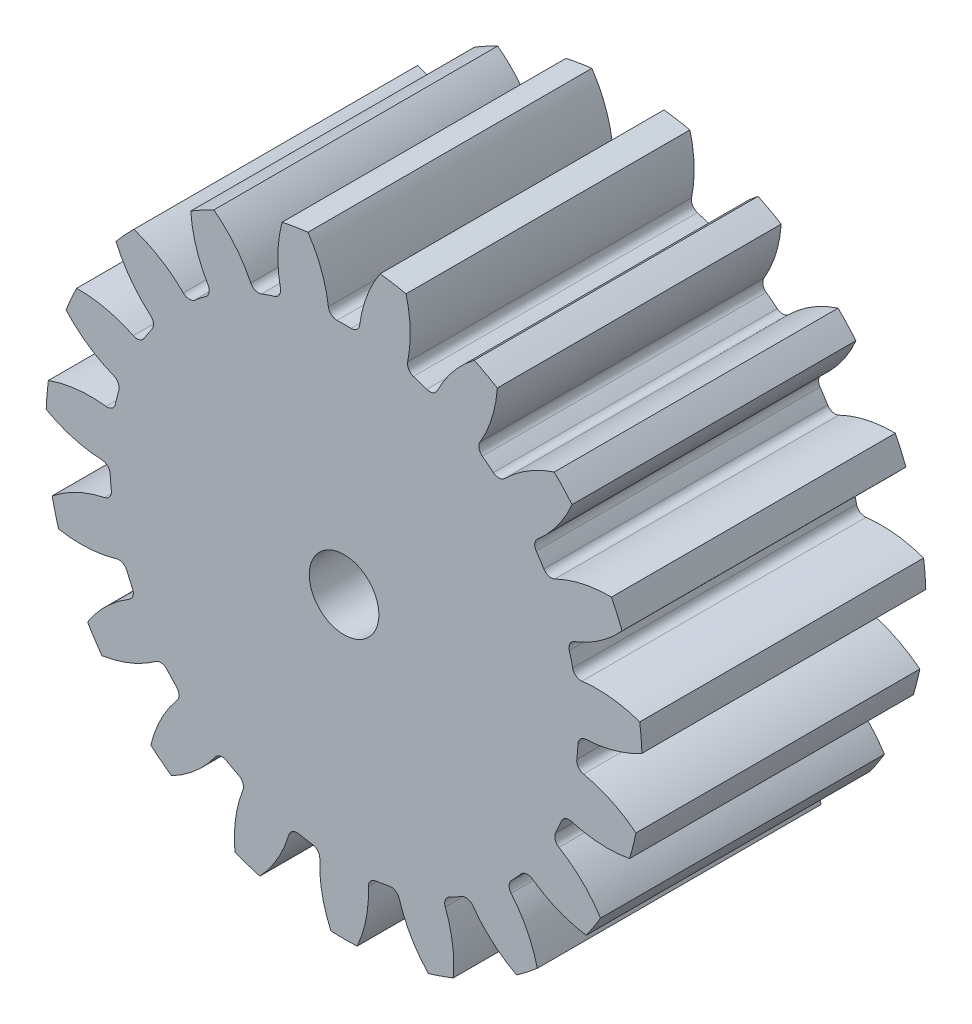
from build123d import *

# Parameters (mm, degrees)
SKETCH1_R                = 21
BOSS_EXTRUDE1_DEPTH      = 10
CUT_EXTRUDE2_DEPTH       = 32.336879232
FILLET1_R                = 0.6
CIRPATTERN3_COUNT        = 19
FILLET1_OF_CIRPATTERN3_R = 0.6
SKETCH3_R                = 2.45
CUT_EXTRUDE3_DEPTH       = 36.795867914
CUT_EXTRUDE4_DEPTH       = 11


with BuildPart() as part:
    # Sketch1 → Boss-Extrude1 (new, symmetric)
    with BuildSketch(Plane.XY):
        Circle(SKETCH1_R)
    extrude(amount=BOSS_EXTRUDE1_DEPTH, both=True)

    # Sketch2 → Cut-Extrude2 (cut, symmetric)
    with BuildSketch(Plane.XY):
        with BuildLine():
            ThreePointArc((-3.243684771, 21.759561326), (-1.708845639, 19.294769345), (-1.052023706, 16.466427849))
            ThreePointArc((-1.052023706, 16.466427849), (0, 16.5), (1.052023706, 16.466427849))
            ThreePointArc((1.052023706, 16.466427849), (1.708845639, 19.294769345), (3.243684771, 21.759561326))
            ThreePointArc((3.243684771, 21.759561326), (0, 22), (-3.243684771, 21.759561326))
        make_face()
    cut_extrude2 = extrude(amount=CUT_EXTRUDE2_DEPTH, both=True, mode=Mode.SUBTRACT)

    # Fillet1
    fillet1_edges = [part.edges().sort_by_distance(p)[0] for p in [
        (-1.052023706, 16.466427849, 0),
        (1.052023706, 16.466427849, 0),
    ]]
    fillet(fillet1_edges, radius=FILLET1_R)

    # CirPattern3: Cut-Extrude2 ×19 about axis
    cirpattern3_axis = Axis((0, 0, 0), (0, 0, 1))
    for i in range(1, CIRPATTERN3_COUNT):
        add(cut_extrude2.rotate(cirpattern3_axis, i * 360 / CIRPATTERN3_COUNT), mode=Mode.SUBTRACT)

    # Fillet1 of CirPattern3
    fillet1_of_cirpattern3_edges = [part.edges().sort_by_distance(p)[0] for p in [
        (-6.341662543, 15.23263983, 0),
        (-4.351618222, 15.915822908, 0),
        (-10.944083841, 12.348158927, 0),
        (-9.283694794, 13.640491596, 0),
        (-14.360543841, 8.125563402, 0),
        (-13.209738984, 9.887001364, 0),
        (-16.220816088, 3.022437001, 0),
        (-15.704302984, 5.062101123, 0),
        (-16.323311221, -2.408217346, 0),
        (-16.497062079, -0.311356322, 0),
        (-14.6569223, -7.577903977, 0),
        (-15.502108519, -5.651073478, 0),
        (-11.402228423, -11.926407128, 0),
        (-12.827260961, -10.378409138, 0),
        (-6.911926172, -14.98249901, 0),
        (-8.762380643, -13.981083129, 0),
        (-1.672609471, -16.415004647, 0),
        (-3.747960419, -16.068689825, 0),
        (3.747960419, -16.068689825, 0),
        (1.672609471, -16.415004647, 0),
        (8.762380643, -13.981083129, 0),
        (6.911926172, -14.98249901, 0),
        (12.827260961, -10.378409138, 0),
        (11.402228423, -11.926407128, 0),
        (15.502108519, -5.651073478, 0),
        (14.6569223, -7.577903977, 0),
        (16.497062079, -0.311356322, 0),
        (16.323311221, -2.408217346, 0),
        (15.704302984, 5.062101123, 0),
        (16.220816088, 3.022437001, 0),
        (13.209738984, 9.887001364, 0),
        (14.360543841, 8.125563402, 0),
        (9.283694794, 13.640491596, 0),
        (10.944083841, 12.348158927, 0),
        (4.351618222, 15.915822908, 0),
        (6.341662543, 15.23263983, 0),
    ]]
    fillet(fillet1_of_cirpattern3_edges, radius=FILLET1_OF_CIRPATTERN3_R)

    # Sketch3 → Cut-Extrude3 (cut, through all)
    with BuildSketch(Plane(origin=(0, 0, -10), x_dir=(-1, 0, 0), z_dir=(0, 0, -1))):
        Circle(SKETCH3_R)
    extrude(amount=-CUT_EXTRUDE3_DEPTH, mode=Mode.SUBTRACT)

    # Sketch4 → Cut-Extrude4 (cut)
    with BuildSketch(Plane(origin=(0, 0, -10), x_dir=(-1, 0, 0), z_dir=(0, 0, -1))):
        with BuildLine():
            ThreePointArc((0.594506224, 6.081008333), (0, 5.4), (-0.594506224, 6.081008333))
            ThreePointArc((-0.594506224, 6.081008333), (-0.955814581, 6.034775761), (-1.3137259, 5.967095127))
            ThreePointArc((-1.3137259, 5.967095127), (-1.66869177, 5.135705188), (-2.444543936, 5.599670075))
            ThreePointArc((-2.444543936, 5.599670075), (-2.773881953, 5.444049863), (-3.093361379, 5.269081075))
            ThreePointArc((-3.093361379, 5.269081075), (-3.174040362, 4.36869177), (-4.055292656, 4.570197094))
            ThreePointArc((-4.055292656, 4.570197094), (-4.320422433, 4.320422433), (-4.570197094, 4.055292656))
            ThreePointArc((-4.570197094, 4.055292656), (-4.36869177, 3.174040362), (-5.269081075, 3.093361379))
            ThreePointArc((-5.269081075, 3.093361379), (-5.444049863, 2.773881953), (-5.599670075, 2.444543936))
            ThreePointArc((-5.599670075, 2.444543936), (-5.135705188, 1.66869177), (-5.967095127, 1.3137259))
            ThreePointArc((-5.967095127, 1.3137259), (-6.034775761, 0.955814581), (-6.081008333, 0.594506224))
            ThreePointArc((-6.081008333, 0.594506224), (-5.4, 0), (-6.081008333, -0.594506224))
            ThreePointArc((-6.081008333, -0.594506224), (-6.034775761, -0.955814581), (-5.967095127, -1.3137259))
            ThreePointArc((-5.967095127, -1.3137259), (-5.135705188, -1.66869177), (-5.599670075, -2.444543936))
            ThreePointArc((-5.599670075, -2.444543936), (-5.444049863, -2.773881953), (-5.269081075, -3.093361379))
            ThreePointArc((-5.269081075, -3.093361379), (-4.36869177, -3.174040362), (-4.570197094, -4.055292656))
            ThreePointArc((-4.570197094, -4.055292656), (-4.320422433, -4.320422433), (-4.055292656, -4.570197094))
            ThreePointArc((-4.055292656, -4.570197094), (-3.174040362, -4.36869177), (-3.093361379, -5.269081075))
            ThreePointArc((-3.093361379, -5.269081075), (-2.773881953, -5.444049863), (-2.444543936, -5.599670075))
            ThreePointArc((-2.444543936, -5.599670075), (-1.66869177, -5.135705188), (-1.3137259, -5.967095127))
            ThreePointArc((-1.3137259, -5.967095127), (-0.955814581, -6.034775761), (-0.594506224, -6.081008333))
            ThreePointArc((-0.594506224, -6.081008333), (0, -5.4), (0.594506224, -6.081008333))
            ThreePointArc((0.594506224, -6.081008333), (0.955814581, -6.034775761), (1.3137259, -5.967095127))
            ThreePointArc((1.3137259, -5.967095127), (1.66869177, -5.135705188), (2.444543936, -5.599670075))
            ThreePointArc((2.444543936, -5.599670075), (2.773881953, -5.444049863), (3.093361379, -5.269081075))
            ThreePointArc((3.093361379, -5.269081075), (3.174040362, -4.36869177), (4.055292656, -4.570197094))
            ThreePointArc((4.055292656, -4.570197094), (4.320422433, -4.320422433), (4.570197094, -4.055292656))
            ThreePointArc((4.570197094, -4.055292656), (4.36869177, -3.174040362), (5.269081075, -3.093361379))
            ThreePointArc((5.269081075, -3.093361379), (5.444049863, -2.773881953), (5.599670075, -2.444543936))
            ThreePointArc((5.599670075, -2.444543936), (5.135705188, -1.66869177), (5.967095127, -1.3137259))
            ThreePointArc((5.967095127, -1.3137259), (6.034775761, -0.955814581), (6.081008333, -0.594506224))
            ThreePointArc((6.081008333, -0.594506224), (5.4, 0), (6.081008333, 0.594506224))
            ThreePointArc((6.081008333, 0.594506224), (6.034775761, 0.955814581), (5.967095127, 1.3137259))
            ThreePointArc((5.967095127, 1.3137259), (5.135705188, 1.66869177), (5.599670075, 2.444543936))
            ThreePointArc((5.599670075, 2.444543936), (5.444049863, 2.773881953), (5.269081075, 3.093361379))
            ThreePointArc((5.269081075, 3.093361379), (4.36869177, 3.174040362), (4.570197094, 4.055292656))
            ThreePointArc((4.570197094, 4.055292656), (4.320422433, 4.320422433), (4.055292656, 4.570197094))
            ThreePointArc((4.055292656, 4.570197094), (3.174040362, 4.36869177), (3.093361379, 5.269081075))
            ThreePointArc((3.093361379, 5.269081075), (2.773881953, 5.444049863), (2.444543936, 5.599670075))
            ThreePointArc((2.444543936, 5.599670075), (1.66869177, 5.135705188), (1.3137259, 5.967095127))
            ThreePointArc((1.3137259, 5.967095127), (0.955814581, 6.034775761), (0.594506224, 6.081008333))
        make_face()
    extrude(amount=-CUT_EXTRUDE4_DEPTH, mode=Mode.SUBTRACT)


solid = part.part
